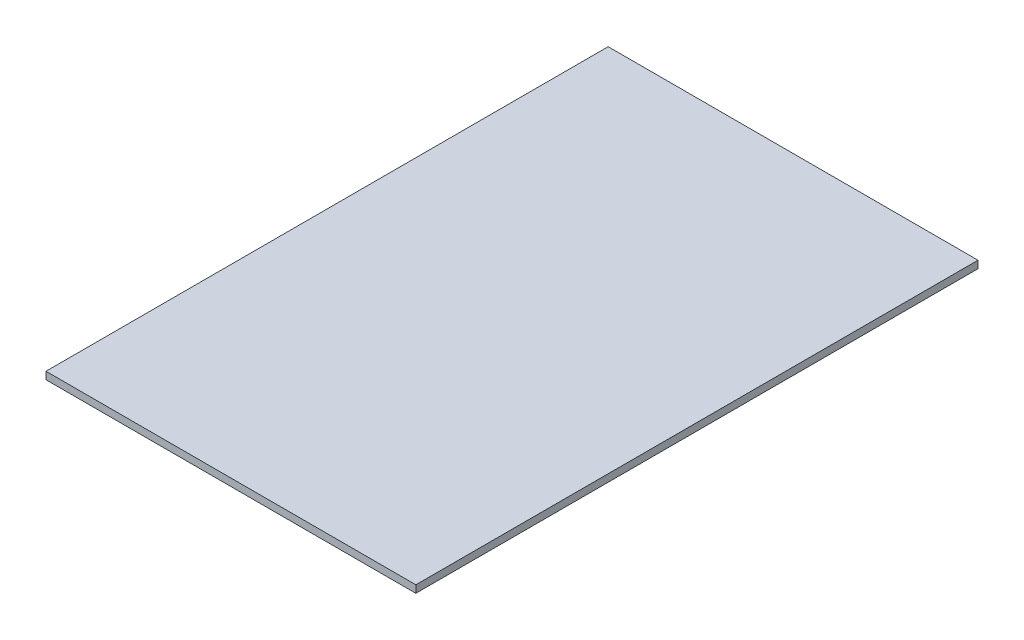
from build123d import *

# Parameters (mm, degrees)
SKETCH1_W           = 317.5
SKETCH1_H           = 482.6
BOSS_EXTRUDE1_DEPTH = 6.35


with BuildPart() as part:
    # Sketch1 → Boss-Extrude1 (new body)
    with BuildSketch(Plane(origin=(0, 0, 0), x_dir=(1, 0, 0), z_dir=(0, 1, 0))):
        Rectangle(SKETCH1_W, SKETCH1_H)
    extrude(amount=BOSS_EXTRUDE1_DEPTH)


solid = part.part
